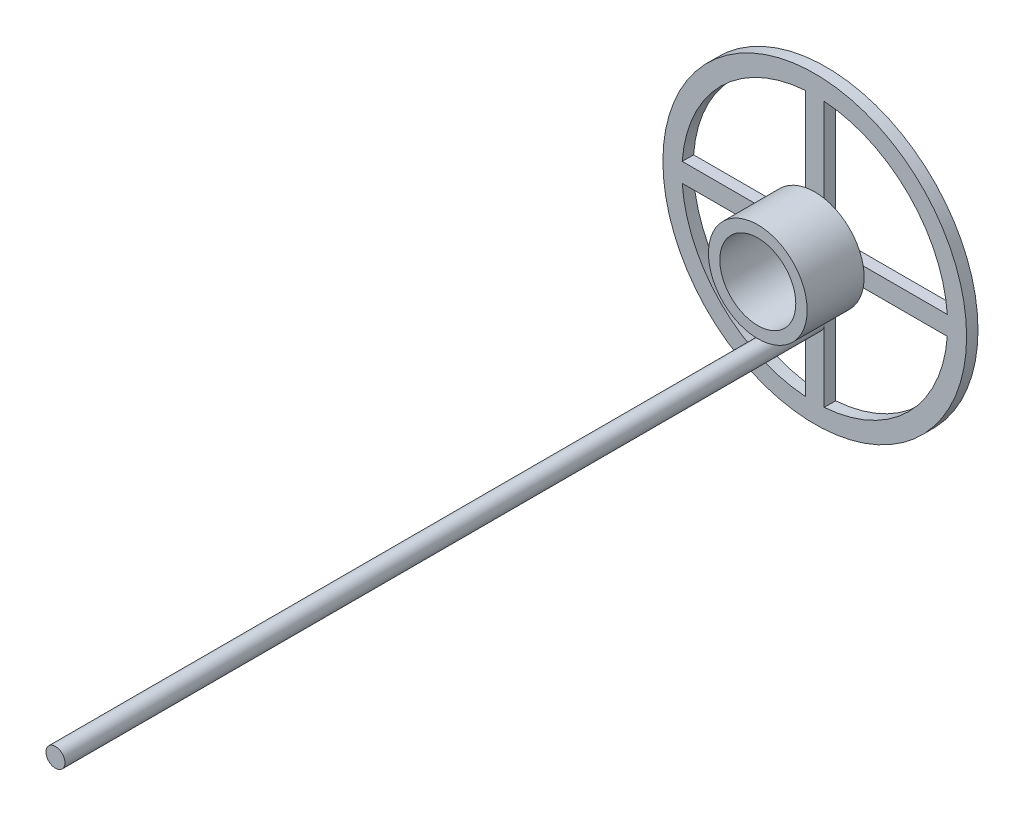
from build123d import *

# Parameters (mm, degrees)
CROQUIS1_R              = 400
SALIENTE_EXTRUIR1_DEPTH = 30
CROQUIS2_R              = 130
CROQUIS2_R_2            = 100
SALIENTE_EXTRUIR2_DEPTH = 150
CROQUIS3_R              = 25
SALIENTE_EXTRUIR3_DEPTH = 2000


with BuildPart() as part:
    # Croquis1 → Saliente-Extruir1 (new body)
    with BuildSketch(Plane(origin=(0, 0, 0), x_dir=(0, 1, 0), z_dir=(0, 0, 1))):
        with Locations(Location((0, 0, 0), (0, 0, 270))):
            Circle(CROQUIS1_R)
        with BuildLine():
            Line((25, -25), (349.106001094, -25))
            ThreePointArc((349.106001094, -25), (247.487373415, -247.487373415), (25, -349.106001094))
            Line((25, -349.106001094), (25, -25))
        make_face(mode=Mode.SUBTRACT)
        with BuildLine():
            Line((-349.106001094, 25), (-25, 25))
            Line((-25, 25), (-25, 349.106001094))
            ThreePointArc((-25, 349.106001094), (-247.487373415, 247.487373415), (-349.106001094, 25))
        make_face(mode=Mode.SUBTRACT)
        with BuildLine():
            Line((-349.106001094, -25), (-25, -25))
            Line((-25, -25), (-25, -349.106001094))
            ThreePointArc((-25, -349.106001094), (-247.487373415, -247.487373415), (-349.106001094, -25))
        make_face(mode=Mode.SUBTRACT)
        with BuildLine():
            Line((25, 25), (25, 349.106001094))
            ThreePointArc((25, 349.106001094), (247.487373415, 247.487373415), (349.106001094, 25))
            Line((349.106001094, 25), (25, 25))
        make_face(mode=Mode.SUBTRACT)
    extrude(amount=SALIENTE_EXTRUIR1_DEPTH)

    # Croquis2 → Saliente-Extruir2 (add)
    with BuildSketch(Plane.XY.offset(30)):
        with Locations(Location((0, 0, 0), (0, 0, 191.087489211))):
            Circle(CROQUIS2_R)
        with Locations(Location((0, 0, 0), (0, 0, 194.477512186))):
            Circle(CROQUIS2_R_2, mode=Mode.SUBTRACT)
    extrude(amount=SALIENTE_EXTRUIR2_DEPTH)


with BuildPart() as body_2:
    # Croquis3 → Saliente-Extruir3 (new body)
    with BuildSketch(Plane.XY.offset(30)):
        with Locations((0, -160)):
            Circle(CROQUIS3_R)
    extrude(amount=SALIENTE_EXTRUIR3_DEPTH)


solid = Compound([part.part, body_2.part])
